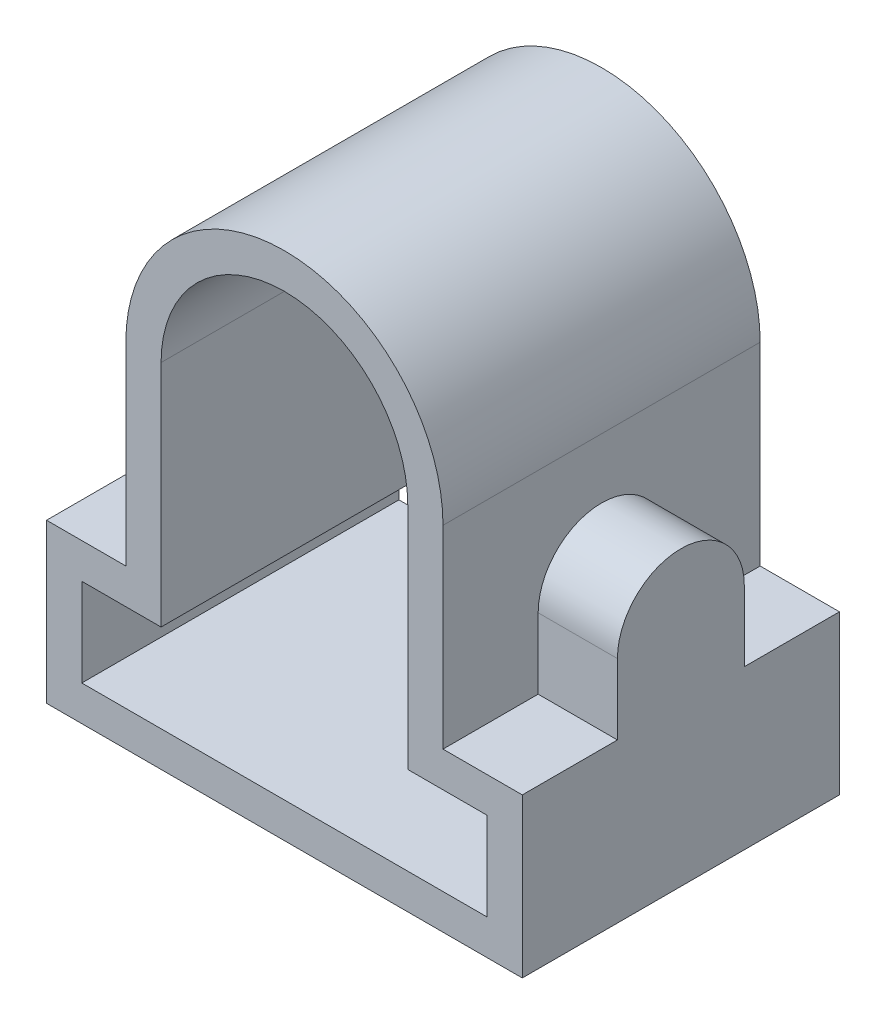
from build123d import *

# Parameters (mm, degrees)
BOSS_EXTRUDE1_DEPTH      = 45
BOSS_EXTRUDE1_DEPTH_BACK = 45
BOSS_EXTRUDE2_DEPTH      = 32


with BuildPart() as part:
    # Sketch1 → Boss-Extrude1 (new, two sides: drawn at the far end of the back side and taken through both)
    with BuildSketch(Plane.XY.offset(-BOSS_EXTRUDE1_DEPTH_BACK)):
        with BuildLine():
            Line((-67.5, 0), (67.5, 0))
            Line((67.5, 0), (67.5, 45))
            Line((67.5, 45), (45, 45))
            Line((45, 45), (45, 100))
            ThreePointArc((45, 100), (0, 145), (-45, 100))
            Line((-45, 100), (-45, 45))
            Line((-45, 45), (-67.5, 45))
            Line((-67.5, 45), (-67.5, 0))
        make_face()
        with BuildLine():
            Line((35, 35), (35, 100))
            ThreePointArc((35, 100), (0, 135), (-35, 100))
            Line((-35, 100), (-35, 35))
            Line((-35, 35), (-57.5, 35))
            Line((-57.5, 35), (-57.5, 10))
            Line((-57.5, 10), (57.5, 10))
            Line((57.5, 10), (57.5, 35))
            Line((57.5, 35), (35, 35))
        make_face(mode=Mode.SUBTRACT)
    extrude(amount=BOSS_EXTRUDE1_DEPTH + BOSS_EXTRUDE1_DEPTH_BACK)

    # Sketch2 → Boss-Extrude2 (add)
    with BuildSketch(Plane(origin=(67.5, 0, 0), x_dir=(0, 0, -1), z_dir=(1, 0, 0))):
        with BuildLine():
            Line((18, 65), (18, 45))
            Line((18, 45), (-18, 45))
            Line((-18, 45), (-18, 65))
            ThreePointArc((-18, 65), (0, 83), (18, 65))
        make_face()
    extrude(amount=-BOSS_EXTRUDE2_DEPTH)


solid = part.part
